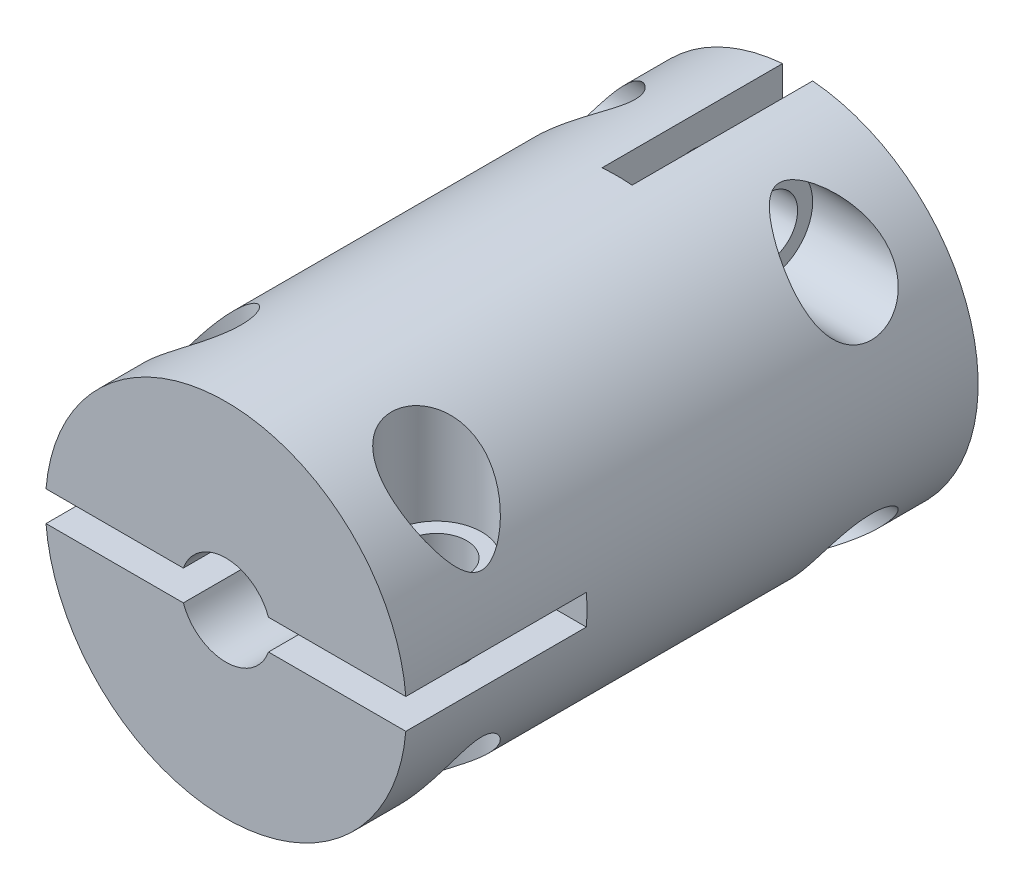
from build123d import *

# Parameters (mm, degrees)
SKETCH_1_R               = 6
EXTRUDE_1_DEPTH          = 19
SKETCH_2_R               = 1.5
CUT_EXTRUDE_1_DEPTH      = 9.5
SKETCH_3_W               = 13.627836578
SKETCH_3_H               = 1
CUT_EXTRUDE_2_DEPTH      = 6
SKETCH_4_W               = 1
SKETCH_4_H               = 12.796097453
CUT_EXTRUDE_3_DEPTH      = 6
CUT_EXTRUDE_5_DEPTH      = 6
CUT_EXTRUDE_5_DEPTH_BACK = 6
SKETCH_5_R               = 1
CUT_EXTRUDE_START        = -2
SKETCH_6_R               = 1.5
CUT_EXTRUDE_6_DEPTH      = 6
SKETCH_7_R               = 1
CUT_EXTRUDE_7_DEPTH      = 6
SKETCH_8_R               = 1.5
CUT_EXTRUDE_8_DEPTH      = 6
SKETCH_9_R               = 2
CUT_EXTRUDE_9_DEPTH      = 9.5


with BuildPart() as part:
    # 草图1 → 凸台-拉伸1 (new body)
    with BuildSketch(Plane.XY):
        Circle(SKETCH_1_R)
    extrude(amount=EXTRUDE_1_DEPTH)

    # 草图2 → 切除-拉伸1 (cut)
    with BuildSketch(Plane.XY.offset(19)):
        Circle(SKETCH_2_R)
    extrude(amount=-CUT_EXTRUDE_1_DEPTH, mode=Mode.SUBTRACT)

    # 草图3 → 切除-拉伸2 (cut)
    with BuildSketch(Plane.XY.offset(19)):
        with Locations((-0.190601878, 0)):
            Rectangle(SKETCH_3_W, SKETCH_3_H)
    extrude(amount=-CUT_EXTRUDE_2_DEPTH, mode=Mode.SUBTRACT)

    # 草图4 → 切除-拉伸3 (cut)
    with BuildSketch(Plane(origin=(0, 0, 0), x_dir=(-1, 0, 0), z_dir=(0, 0, -1))):
        with Locations((0, -0.108476873)):
            Rectangle(SKETCH_4_W, SKETCH_4_H)
    extrude(amount=-CUT_EXTRUDE_3_DEPTH, mode=Mode.SUBTRACT)

    # 草图5 → 切除-拉伸5 (cut, two sides: drawn at the far end of the back side and taken through both)
    with BuildSketch(Plane(origin=(0, 0, 0), x_dir=(1, 0, 0), z_dir=(0, 1, 0)).offset(-CUT_EXTRUDE_5_DEPTH_BACK)):
        with Locations(Location((-4, -16, 0), (0, 0, 90))):
            Circle(SKETCH_5_R)
        with Locations(Location((4, -16, 0), (0, 0, 90))):
            Circle(SKETCH_5_R)
    extrude(amount=CUT_EXTRUDE_5_DEPTH + CUT_EXTRUDE_5_DEPTH_BACK, mode=Mode.SUBTRACT)

    # 草图6 → 切除-拉伸6 (cut)
    with BuildSketch(Plane(origin=(0, 0, 0), x_dir=(1, 0, 0), z_dir=(0, 1, 0)).offset(CUT_EXTRUDE_START)):
        with Locations(Location((-4, -16, 0), (0, 0, 270))):
            Circle(SKETCH_6_R)
        with Locations(Location((4, -16, 0), (0, 0, 270))):
            Circle(SKETCH_6_R)
    cut_extrude_6 = extrude(amount=-CUT_EXTRUDE_6_DEPTH, mode=Mode.SUBTRACT)

    # 镜向1: 切除-拉伸6 across plane
    add(cut_extrude_6.mirror(Plane.ZX), mode=Mode.SUBTRACT)

    # 草图7 → 切除-拉伸7 (cut)
    with BuildSketch(Plane(origin=(0, 0, 0), x_dir=(0, 0, -1), z_dir=(1, 0, 0))):
        with Locations((-3, 4)):
            Circle(SKETCH_7_R)
        with Locations((-3, -4)):
            Circle(SKETCH_7_R)
    cut_extrude_7 = extrude(amount=-CUT_EXTRUDE_7_DEPTH, mode=Mode.SUBTRACT)

    # 草图8 → 切除-拉伸8 (cut)
    with BuildSketch(Plane(origin=(0, 0, 0), x_dir=(0, 0, -1), z_dir=(1, 0, 0)).offset(CUT_EXTRUDE_START)):
        with Locations((-3, -4)):
            Circle(SKETCH_8_R)
        with Locations((-3, 4)):
            Circle(SKETCH_8_R)
    cut_extrude_8 = extrude(amount=-CUT_EXTRUDE_8_DEPTH, mode=Mode.SUBTRACT)

    # 镜向2: 切除-拉伸7, 切除-拉伸8 across plane
    add(cut_extrude_7.mirror(Plane(origin=(0, 0, 0), x_dir=(0, 0, 1), z_dir=(1, 0, 0))), mode=Mode.SUBTRACT)
    add(cut_extrude_8.mirror(Plane(origin=(0, 0, 0), x_dir=(0, 0, 1), z_dir=(1, 0, 0))), mode=Mode.SUBTRACT)

    # 草图9 → 切除-拉伸9 (cut)
    with BuildSketch(Plane(origin=(0, 0, 0), x_dir=(-1, 0, 0), z_dir=(0, 0, -1))):
        Circle(SKETCH_9_R)
    extrude(amount=-CUT_EXTRUDE_9_DEPTH, mode=Mode.SUBTRACT)


solid = part.part
